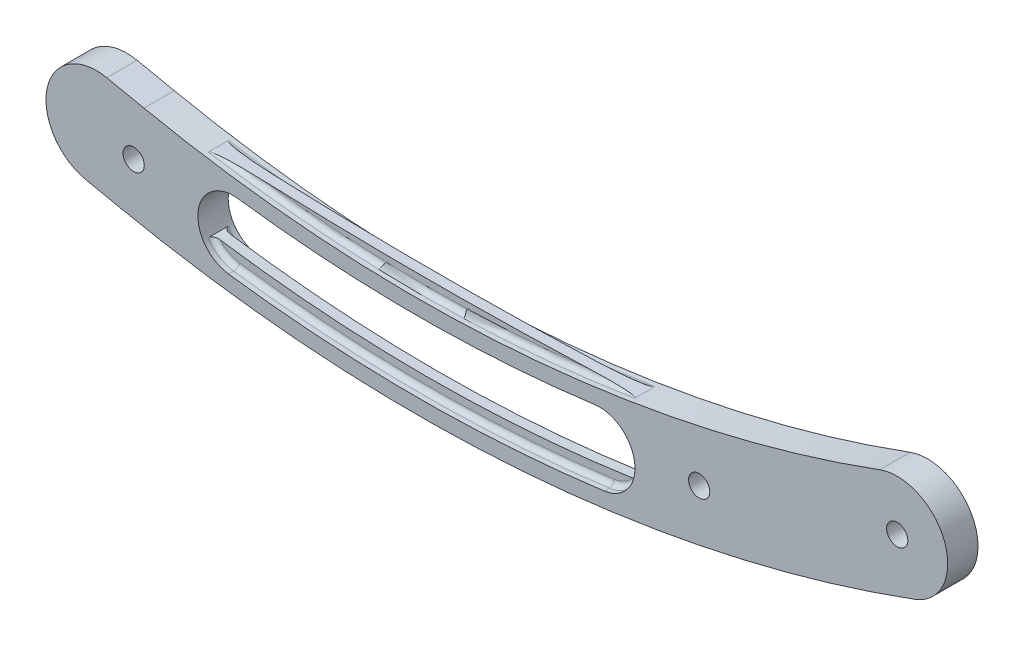
from build123d import *

# Parameters (mm, degrees)
CROQUIS1_R              = 2.1
SALIENTE_EXTRUIR1_DEPTH = 6
SALIENTE_EXTRUIR3_DEPTH = 1
REDONDEO2_R             = 1
SALIENTE_EXTRUIR5_DEPTH = 6


with BuildPart() as part:
    # Croquis1 → Saliente-Extruir1 (new body)
    with BuildSketch(Plane.XY):
        with BuildLine():
            ThreePointArc((-114.035873061, -9.790567955), (-34.858360528, -14.975714339), (42.681169488, 1.864283248))
            ThreePointArc((42.681169488, 1.864283248), (48.601198063, 14.707696411), (35.7577849, 20.627724986))
            ThreePointArc((35.7577849, 20.627724986), (-36.341639472, 4.969206908), (-109.964126939, 9.790567955))
            ThreePointArc((-109.964126939, 9.790567955), (-121.790567955, 2.035873061), (-114.035873061, -9.790567955))
        make_face()
        with Locations((-112, 0)):
            Circle(CROQUIS1_R, mode=Mode.SUBTRACT)
        with Locations((39.219477194, 11.246004117)):
            Circle(CROQUIS1_R, mode=Mode.SUBTRACT)
        Circle(CROQUIS1_R, mode=Mode.SUBTRACT)
        with BuildLine():
            ThreePointArc((-18.792854848, -10.296017287), (-12.777386897, -2.433820054), (-20.63958413, 3.581647897))
            ThreePointArc((-20.63958413, 3.581647897), (-56, 1.239230948), (-91.36041587, 3.581647897))
            ThreePointArc((-91.36041587, 3.581647897), (-99.222613103, -2.433820054), (-93.207145152, -10.296017287))
            ThreePointArc((-93.207145152, -10.296017287), (-56, -12.760769052), (-18.792854848, -10.296017287))
        make_face(mode=Mode.SUBTRACT)
    extrude(amount=SALIENTE_EXTRUIR1_DEPTH)

    # Croquis3 → Saliente-Extruir3 (add, symmetric)
    with BuildSketch(Plane.XY.offset(3)):
        with BuildLine():
            ThreePointArc((-98.228577232, -7.053046158), (-96.081427883, -9.237480134), (-93.207145152, -10.296017287))
            ThreePointArc((-93.207145152, -10.296017287), (-56, -12.760769052), (-18.792854848, -10.296017287))
            ThreePointArc((-18.792854848, -10.296017287), (-15.918572117, -9.237480134), (-13.771422768, -7.053046158))
            ThreePointArc((-13.771422768, -7.053046158), (-56, -10.260769052), (-98.228577232, -7.053046158))
        make_face()
        with BuildLine():
            ThreePointArc((-98.228577232, 7.624636675), (-56, 6.557109307), (-13.771422768, 7.624636675))
            ThreePointArc((-13.771422768, 7.624636675), (-56, 4.239230948), (-98.228577232, 7.624636675))
        make_face()
    extrude(amount=SALIENTE_EXTRUIR3_DEPTH, both=True)

    # Redondeo2
    redondeo2_edges = [part.edges().sort_by_distance(p)[0] for p in [
        (-96.081427883, -9.237480134, 2),
        (-56, -12.760769052, 2),
        (-15.918572117, -9.237480134, 2),
        (-96.081427883, -9.237480134, 4),
        (-56, -12.760769052, 4),
        (-15.918572117, -9.237480134, 4),
        (-56, 4.239230948, 2),
        (-56, 4.239230948, 4),
    ]]
    fillet(redondeo2_edges, radius=REDONDEO2_R)

    # Croquis1<3> → Saliente-Extruir5 (add)
    with BuildSketch(Plane.XY):
        with BuildLine():
            ThreePointArc((-121.405666345, -8.258076308), (-129.160361239, 3.568364708), (-117.333920224, 11.323059602))
            Line((-117.333920224, 11.323059602), (-109.964126939, 9.790567955))
            ThreePointArc((-109.964126939, 9.790567955), (-121.790567955, 2.035873061), (-114.035873061, -9.790567955))
            Line((-114.035873061, -9.790567955), (-121.405666345, -8.258076308))
        make_face()
    extrude(amount=SALIENTE_EXTRUIR5_DEPTH)


solid = part.part
